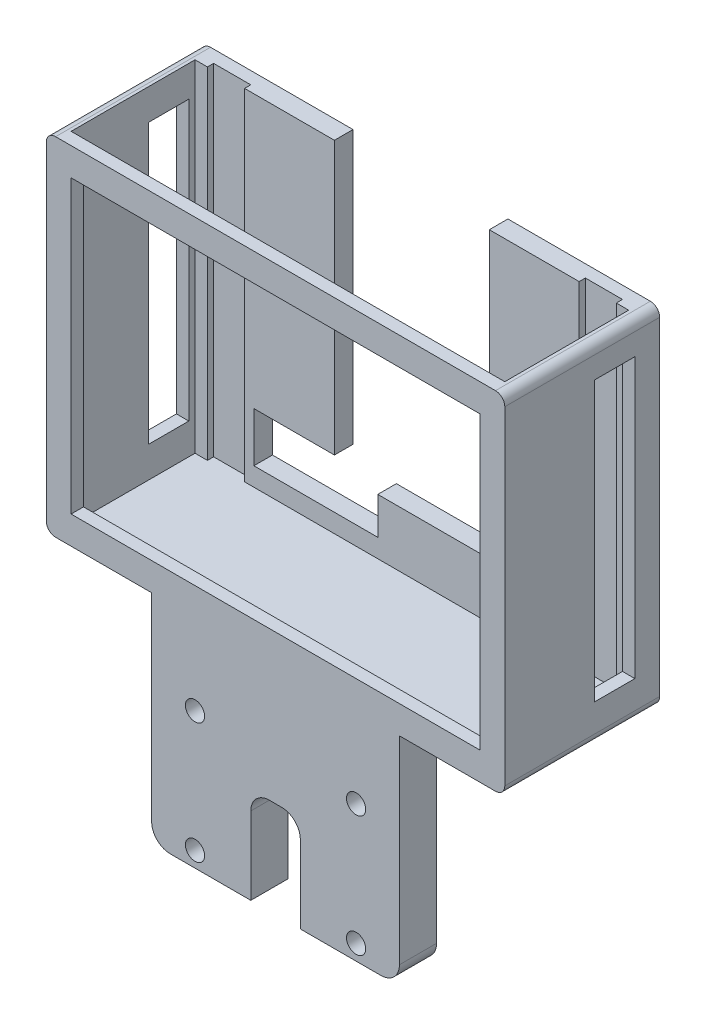
from build123d import *

# Parameters (mm, degrees)
SKETCH_1_W          = 80
SKETCH_1_H          = 60
EXTRUDE_1_DEPTH     = 3
CUT_EXTRUDE_1_DEPTH = 3
EXTRUDE_2_DEPTH     = 20
SKETCH_4_W          = 6.5
SKETCH_4_H          = 45
CUT_EXTRUDE_2_DEPTH = 89.481636513
SKETCH_5_W          = 6
SKETCH_5_H          = 55
CUT_EXTRUDE_3_DEPTH = 1
SKETCH_7_W          = 20
SKETCH_7_H          = 8
SKETCH_7_W_2        = 12
CUT_EXTRUDE_4_DEPTH = 3
SKETCH_8_W          = 66
SKETCH_8_H          = 47
EXTRUDE_3_DEPTH     = 2
CUT_EXTRUDE_5_DEPTH = 56.901699437
CUT_EXTRUDE_6_DEPTH = 54.795910625
SKETCH_12_W         = 40
SKETCH_12_H         = 6
EXTRUDE_4_DEPTH     = 35
SKETCH_13_R         = 1.55
CUT_EXTRUDE_7_DEPTH = 76.59761901


with BuildPart() as part:
    # 草图1 → 凸台-拉伸1 (new body)
    with BuildSketch(Plane.XY):
        Rectangle(SKETCH_1_W, SKETCH_1_H)
    extrude(amount=EXTRUDE_1_DEPTH)

    # 草图2 → 切除-拉伸1 (cut)
    with BuildSketch(Plane.XY.offset(3)):
        Polygon((-12.5, -8.5), (-12.5, 8.5), (-12.5, 30), (12.5, 30), (12.5, 8.5), (12.5, -8.5), (12.5, -16), (-12.5, -16), align=None)
    extrude(amount=-CUT_EXTRUDE_1_DEPTH, mode=Mode.SUBTRACT)

    # 草图3 → 凸台-拉伸2 (add)
    with BuildSketch(Plane.XY.offset(3)):
        Polygon((-40, 30), (-35, 30), (-35, -25), (35, -25), (35, 30), (40, 30), (40, -30), (-40, -30), align=None)
    extrude(amount=EXTRUDE_2_DEPTH)

    # 草图4 → 切除-拉伸2 (cut, through all)
    with BuildSketch(Plane.ZY.offset(40)):
        with Locations((7.25, 2.5)):
            Rectangle(SKETCH_4_W, SKETCH_4_H)
    extrude(amount=-CUT_EXTRUDE_2_DEPTH, mode=Mode.SUBTRACT)

    # 草图5 → 切除-拉伸3 (cut)
    with BuildSketch(Plane.XY.offset(3)):
        with Locations((-30, 2.5)):
            Rectangle(SKETCH_5_W, SKETCH_5_H)
        with Locations((30, 2.5)):
            Rectangle(SKETCH_5_W, SKETCH_5_H)
    extrude(amount=-CUT_EXTRUDE_3_DEPTH, mode=Mode.SUBTRACT)

    # 草图7 → 切除-拉伸4 (cut)
    with BuildSketch(Plane.XY.offset(3)):
        with Locations((-15.5, -18)):
            Rectangle(SKETCH_7_W, SKETCH_7_H)
        with Locations((19.5, -18)):
            Rectangle(SKETCH_7_W_2, SKETCH_7_H)
    extrude(amount=-CUT_EXTRUDE_4_DEPTH, mode=Mode.SUBTRACT)

    # 草图8 → 凸台-拉伸3 (add)
    with BuildSketch(Plane.XY.offset(23)):
        Polygon((-40, 30), (-32, 30), (32, 30), (40, 30), (40, -30), (-40, -30), align=None)
        with Locations((0, 2)):
            Rectangle(SKETCH_8_W, SKETCH_8_H, mode=Mode.SUBTRACT)
    extrude(amount=EXTRUDE_3_DEPTH)

    # 草图9 → 切除-拉伸5 (cut, through all)
    with BuildSketch(Plane.XY.offset(25)):
        Polygon((-40, 30), (-37, 30), (-37, -26), (37, -26), (37, 30), (40, 30), (40, -30), (38, -30), (-38, -30), (-40, -30), align=None)
    extrude(amount=-CUT_EXTRUDE_5_DEPTH, mode=Mode.SUBTRACT)

    # 草图11 → 切除-拉伸6 (cut, through all)
    with BuildSketch(Plane.XY.offset(25)):
        with BuildLine():
            Line((-35.5, 30), (-37, 30))
            Line((-37, 30), (-37, 28.5))
            ThreePointArc((-37, 28.5), (-36.560660172, 29.560660172), (-35.5, 30))
        make_face()
        with BuildLine():
            Line((-37, -24.5), (-37, -26))
            Line((-37, -26), (-35.5, -26))
            ThreePointArc((-35.5, -26), (-36.560660172, -25.560660172), (-37, -24.5))
        make_face()
        with BuildLine():
            Line((37, -24.5), (37, -26))
            Line((37, -26), (35.5, -26))
            ThreePointArc((35.5, -26), (36.560660172, -25.560660172), (37, -24.5))
        make_face()
        with BuildLine():
            Line((35.5, 30), (37, 30))
            Line((37, 30), (37, 28.5))
            ThreePointArc((37, 28.5), (36.560660172, 29.560660172), (35.5, 30))
        make_face()
    extrude(amount=-CUT_EXTRUDE_6_DEPTH, mode=Mode.SUBTRACT)

    # 草图12 → 凸台-拉伸4 (add)
    with BuildSketch(Plane.XZ.offset(26)):
        with Locations((0, 22)):
            Rectangle(SKETCH_12_W, SKETCH_12_H)
    extrude(amount=EXTRUDE_4_DEPTH)

    # 草图13 → 切除-拉伸7 (cut, through all)
    with BuildSketch(Plane.XY.offset(25)):
        with Locations((-13, -39)):
            Circle(SKETCH_13_R)
        with Locations((13, -39)):
            Circle(SKETCH_13_R)
        with Locations((-13, -58.5)):
            Circle(SKETCH_13_R)
        with Locations((13, -58.5)):
            Circle(SKETCH_13_R)
        with BuildLine():
            Line((-4, -61), (4, -61))
            Line((4, -61), (4, -48.5))
            ThreePointArc((4, -48.5), (3.121320344, -46.378679656), (1, -45.5))
            Line((1, -45.5), (0, -45.5))
            Line((0, -45.5), (-1, -45.5))
            ThreePointArc((-1, -45.5), (-3.121320344, -46.378679656), (-4, -48.5))
            Line((-4, -48.5), (-4, -61))
        make_face()
        with BuildLine():
            Line((20, -58), (20, -61))
            Line((20, -61), (17, -61))
            ThreePointArc((17, -61), (19.121320344, -60.121320344), (20, -58))
        make_face()
        with BuildLine():
            Line((-20, -58), (-20, -61))
            Line((-20, -61), (-17, -61))
            ThreePointArc((-17, -61), (-19.121320344, -60.121320344), (-20, -58))
        make_face()
    extrude(amount=-CUT_EXTRUDE_7_DEPTH, mode=Mode.SUBTRACT)


solid = part.part
